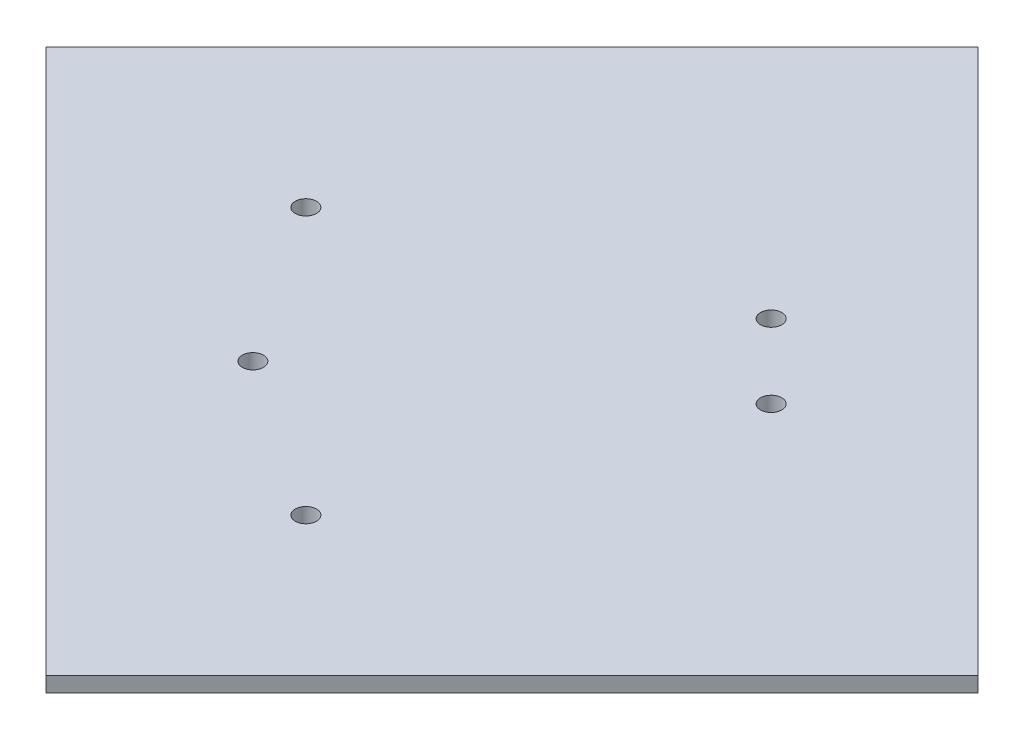
from build123d import *

# Parameters (mm, degrees)
SKETCH1_R           = 2.101545833
BOSS_EXTRUDE1_DEPTH = 3


with BuildPart() as part:
    # Sketch1 → Boss-Extrude1 (new body)
    with BuildSketch(Plane(origin=(0, 0, 0), x_dir=(-1, 0, 0), z_dir=(0, 1, 0))):
        Polygon((51.07729269, -56.750060551), (-56.750060551, 51.07729269), (-36.275076594, 71.552276646), (35.504218501, 143.331571742), (143.331571742, 35.504218501), (71.552276646, -36.275076594), align=None)
        with Locations(Location((24.944747378, 10.332452674, 0), (0, 0, 90))):
            Circle(SKETCH1_R, mode=Mode.SUBTRACT)
        with Locations(Location((10.332452674, 24.944747378, 0), (0, 0, 90))):
            Circle(SKETCH1_R, mode=Mode.SUBTRACT)
        with Locations(Location((90.07825442, 37.311634656, 0), (0, 0, 90))):
            Circle(SKETCH1_R, mode=Mode.SUBTRACT)
        with Locations(Location((68.942911166, 68.942911166, 0), (0, 0, 90))):
            Circle(SKETCH1_R, mode=Mode.SUBTRACT)
        with Locations(Location((37.311634656, 90.07825442, 0), (0, 0, 90))):
            Circle(SKETCH1_R, mode=Mode.SUBTRACT)
    extrude(amount=BOSS_EXTRUDE1_DEPTH)


solid = part.part
